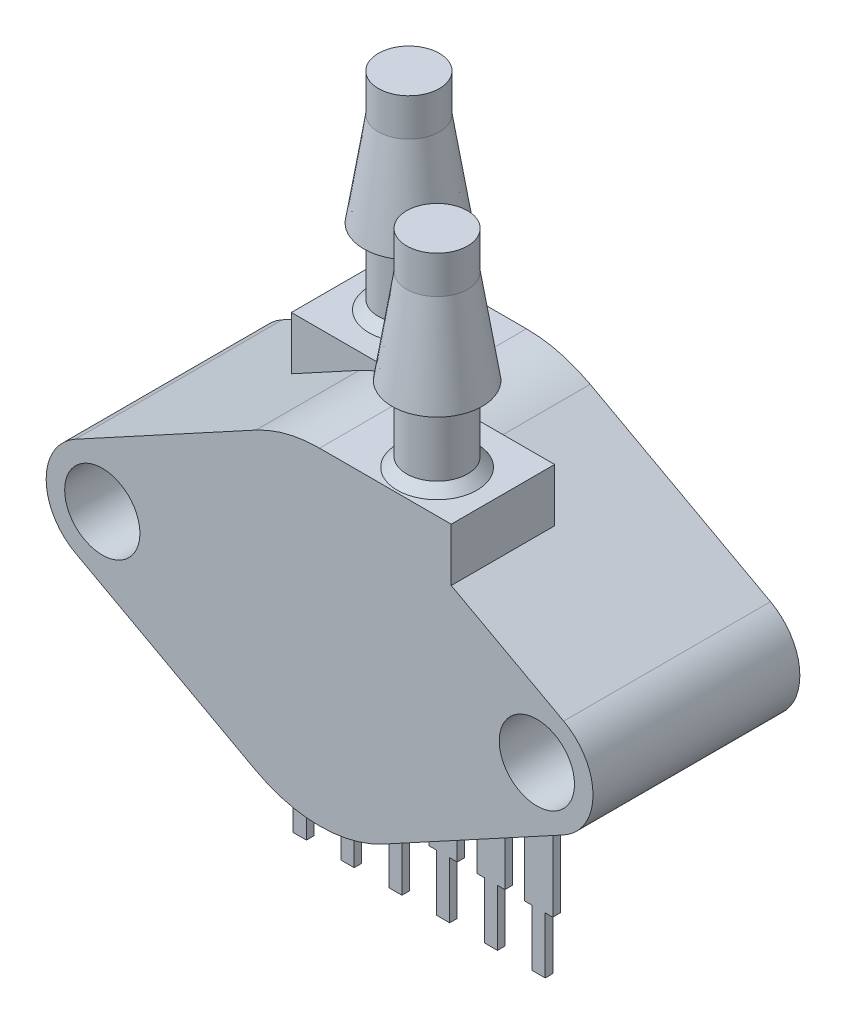
from build123d import *

# Parameters (mm, degrees)
ESQUISSE1_R                  = 2
BOSS_EXTRU_1_DEPTH           = 5.5
BOSS_EXTRU_3_DEPTH           = 5.5
R_P_TITION_CIRCULAIRE1_COUNT = 2
CHANFREIN1_SIZE              = 0.5
ESQUISSE5_W                  = 1.5
ESQUISSE5_H                  = 0.4
BOSS_EXTRU_4_DEPTH           = 12
BOSS_EXTRU_4_2_DEPTH         = 12
BOSS_EXTRU_4_3_DEPTH         = 12
BOSS_EXTRU_4_4_DEPTH         = 12
BOSS_EXTRU_4_5_DEPTH         = 12
BOSS_EXTRU_4_6_DEPTH         = 12
ESQUISSE6_W                  = 0.7
ESQUISSE6_H                  = 0.4
BOSS_EXTRU_5_DEPTH           = 3


with BuildPart() as part:
    # Esquisse1 → Boss.-Extru.1 (new, symmetric)
    with BuildSketch(Plane.XY):
        with BuildLine():
            Line((3.391918261, 7.837323774), (12.981118348, 2.622291261))
            ThreePointArc((12.981118348, 2.622291261), (14.54, 0), (12.981118348, -2.622291261))
            Line((12.981118348, -2.622291261), (3.391918261, -7.837323774))
            ThreePointArc((3.391918261, -7.837323774), (0, -8.7), (-3.391918261, -7.837323774))
            Line((-3.391918261, -7.837323774), (-12.981118348, -2.622291261))
            ThreePointArc((-12.981118348, -2.622291261), (-14.54, 0), (-12.981118348, 2.622291261))
            Line((-12.981118348, 2.622291261), (-3.391918261, 7.837323774))
            ThreePointArc((-3.391918261, 7.837323774), (0, 8.7), (3.391918261, 7.837323774))
        make_face()
        with Locations((11.555, 0)):
            Circle(ESQUISSE1_R, mode=Mode.SUBTRACT)
        with Locations((-11.555, 0)):
            Circle(ESQUISSE1_R, mode=Mode.SUBTRACT)
    extrude(amount=BOSS_EXTRU_1_DEPTH, both=True)

    # Esquisse3 → Boss.-Extru.3 (add)
    with BuildSketch(Plane.XY.offset(5.5)):
        with BuildLine():
            Line((0, 8.7), (7, 8.7))
            Line((7, 8.7), (7, 5.875088821))
            Line((7, 5.875088821), (3.391918261, 7.837323774))
            ThreePointArc((3.391918261, 7.837323774), (1.749951411, 8.480951731), (0, 8.7))
        make_face()
    boss_extru_3 = extrude(amount=-BOSS_EXTRU_3_DEPTH)

    # Esquisse4 → Révolution1 (revolve)
    with BuildSketch(Plane.XY.offset(3.25)):
        Polygon((4, 8.7), (4, 19.7), (2.378292997, 19.7), (2.378292997, 17.7), (1.6, 12.7), (2.378292997, 12.7), (2.378292997, 8.7), align=None)
    r_volution1 = revolve(axis=Axis((4, 8.7, 3.25), (0, 1, 0)))

    # Répétition circulaire1: Boss.-Extru.3, Révolution1 ×2 about axis
    r_p_tition_circulaire1_axis = Axis((0, -10.12, 0), (0, 1, 0))
    add([boss_extru_3.rotate(r_p_tition_circulaire1_axis, i * 360 / R_P_TITION_CIRCULAIRE1_COUNT) for i in range(1, R_P_TITION_CIRCULAIRE1_COUNT)])
    add([r_volution1.rotate(r_p_tition_circulaire1_axis, i * 360 / R_P_TITION_CIRCULAIRE1_COUNT) for i in range(1, R_P_TITION_CIRCULAIRE1_COUNT)])

    # Chanfrein1
    chanfrein1_edges = [part.edges().sort_by_distance(p)[0] for p in [
        (-5.621707003, 8.7, -3.25),
        (5.621707003, 8.7, 3.25),
    ]]
    chamfer(chanfrein1_edges, length=CHANFREIN1_SIZE)


with BuildPart() as body_2:
    # Esquisse5 → Boss.-Extru.4 (new body)
    with BuildSketch(Plane(origin=(0, 0, 0), x_dir=(-1, 0, 0), z_dir=(0, -1, 0))):
        with Locations((1.27, 0)):
            Rectangle(ESQUISSE5_W, ESQUISSE5_H)
    extrude(amount=BOSS_EXTRU_4_DEPTH)



with BuildPart() as body_3:
    # Esquisse5 → Boss.-Extru.4 2 (new body)
    with BuildSketch(Plane(origin=(0, 0, 0), x_dir=(-1, 0, 0), z_dir=(0, -1, 0))):
        with Locations((3.81, 0)):
            Rectangle(ESQUISSE5_W, ESQUISSE5_H)
    extrude(amount=BOSS_EXTRU_4_2_DEPTH)


with BuildPart() as body_4:
    # Esquisse5 → Boss.-Extru.4 3 (new body)
    with BuildSketch(Plane(origin=(0, 0, 0), x_dir=(-1, 0, 0), z_dir=(0, -1, 0))):
        with Locations((6.35, 0)):
            Rectangle(ESQUISSE5_W, ESQUISSE5_H)
    extrude(amount=BOSS_EXTRU_4_3_DEPTH)


with BuildPart() as body_5:
    # Esquisse5 → Boss.-Extru.4 4 (new body)
    with BuildSketch(Plane(origin=(0, 0, 0), x_dir=(-1, 0, 0), z_dir=(0, -1, 0))):
        with Locations((-6.35, 0)):
            Rectangle(ESQUISSE5_W, ESQUISSE5_H)
    extrude(amount=BOSS_EXTRU_4_4_DEPTH)


with BuildPart() as body_6:
    # Esquisse5 → Boss.-Extru.4 5 (new body)
    with BuildSketch(Plane(origin=(0, 0, 0), x_dir=(-1, 0, 0), z_dir=(0, -1, 0))):
        with Locations((-3.81, 0)):
            Rectangle(ESQUISSE5_W, ESQUISSE5_H)
    extrude(amount=BOSS_EXTRU_4_5_DEPTH)


with BuildPart() as body_7:
    # Esquisse5 → Boss.-Extru.4 6 (new body)
    with BuildSketch(Plane(origin=(0, 0, 0), x_dir=(-1, 0, 0), z_dir=(0, -1, 0))):
        with Locations((-1.27, 0)):
            Rectangle(ESQUISSE5_W, ESQUISSE5_H)
    extrude(amount=BOSS_EXTRU_4_6_DEPTH)


with BuildPart() as body_2_1:
    add(body_2.part)

    add(body_3.part)  # Boss.-Extru.5 merges body 3

    add(body_4.part)  # Boss.-Extru.5 merges body 4

    add(body_5.part)  # Boss.-Extru.5 merges body 5

    add(body_6.part)  # Boss.-Extru.5 merges body 6

    add(body_7.part)  # Boss.-Extru.5 merges body 7
    # Esquisse6 → Boss.-Extru.5 (add)
    with BuildSketch(Plane.XZ.offset(12)):
        with Locations((6.35, 0)):
            Rectangle(ESQUISSE6_W, ESQUISSE6_H)
        with Locations((3.81, 0)):
            Rectangle(ESQUISSE6_W, ESQUISSE6_H)
        with Locations((1.27, 0)):
            Rectangle(ESQUISSE6_W, ESQUISSE6_H)
        with Locations((-1.27, 0)):
            Rectangle(ESQUISSE6_W, ESQUISSE6_H)
        with Locations((-3.81, 0)):
            Rectangle(ESQUISSE6_W, ESQUISSE6_H)
        with Locations((-6.35, 0)):
            Rectangle(ESQUISSE6_W, ESQUISSE6_H)
    extrude(amount=BOSS_EXTRU_5_DEPTH)


solid = Compound([part.part, body_2_1.part])
